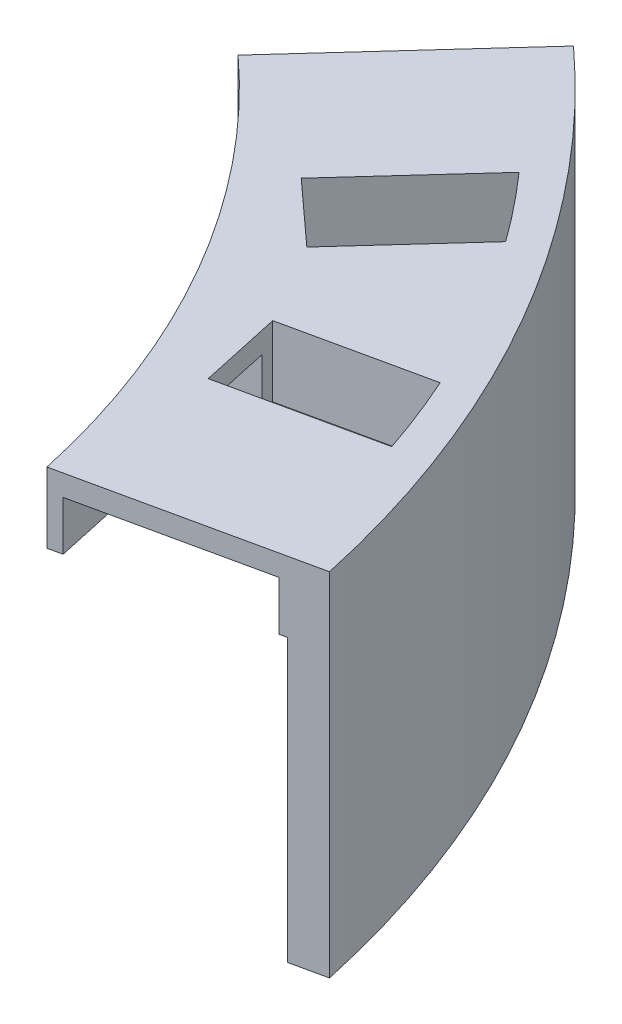
from build123d import *

# Parameters (mm, degrees)
BOSS_EXTRUDE1_DEPTH = 10
CUT_EXTRUDE1_DEPTH  = 7
BOSS_EXTRUDE2_START = -50
BOSS_EXTRUDE2_DEPTH = 50
CUT_EXTRUDE2_DEPTH  = 40
CUT_EXTRUDE3_DEPTH  = 7


with BuildPart() as part:
    # Sketch1 → Boss-Extrude1 (new body)
    with BuildSketch(Plane(origin=(0, 157.279655443, 0), x_dir=(1, 0, 0), z_dir=(0, 1, 0))):
        with BuildLine():
            Line((293.03566289, -316.199227389), (265.928972249, -322.110427169))
            ThreePointArc((265.928972249, -322.110427169), (252.377607393, -287.084094578), (228.819595995, -257.835102061))
            Line((228.819595995, -257.835102061), (247.492190492, -237.315619243))
            ThreePointArc((247.492190492, -237.315619243), (255.674613952, -244.45932236), (263.205967645, -252.286407351))
            Line((263.205967645, -252.286407351), (248.454819921, -268.496576877))
            Line((248.454819921, -268.496576877), (257.330112784, -276.573035048))
            Line((257.330112784, -276.573035048), (270.790876402, -261.780880276))
            ThreePointArc((270.790876402, -261.780880276), (277.704929826, -272.461358153), (283.49746828, -283.789342999))
            Line((283.49746828, -283.789342999), (263.956704662, -288.050628861))
            Line((263.956704662, -288.050628861), (266.513476179, -299.775087033))
            Line((266.513476179, -299.775087033), (287.92746865, -295.105303131))
            ThreePointArc((287.92746865, -295.105303131), (290.940246243, -305.54118925), (293.03566289, -316.199227389))
        make_face()
    extrude(amount=BOSS_EXTRUDE1_DEPTH)

    # Sketch2 → Cut-Extrude1 (cut)
    with BuildSketch(Plane(origin=(0, 157.279655443, 0), x_dir=(1, 0, 0), z_dir=(0, 1, 0))):
        Polygon((267.822908947, -321.697413337), (265.266137429, -309.972955165), (295.554321038, -303.367962079), (297.930502387, -315.13180184), align=None)
        Polygon((251.029855966, -233.428046687), (230.165672357, -256.355886583), (239.04096522, -264.432344755), (259.905148829, -241.504504858), align=None)
    extrude(amount=CUT_EXTRUDE1_DEPTH, mode=Mode.SUBTRACT)

    # Sketch3 → Boss-Extrude2 (add)
    with BuildSketch(Plane(origin=(0, 167.279655443, 0), x_dir=(1, 0, 0), z_dir=(0, 1, 0)).offset(BOSS_EXTRUDE2_START)):
        with BuildLine():
            Line((293.03566289, -316.199227389), (298.897891976, -314.920841631))
            ThreePointArc((298.897891976, -314.920841631), (281.600541129, -270.212225919), (251.530419577, -232.877972811))
            Line((251.530419577, -232.877972811), (247.492190492, -237.315619243))
            ThreePointArc((247.492190492, -237.315619243), (277.704929826, -272.461358153), (293.03566289, -316.199227389))
        make_face()
    extrude(amount=BOSS_EXTRUDE2_DEPTH)

    # Sketch4 → Cut-Extrude2 (cut)
    with BuildSketch(Plane.XZ.offset(-117.279655443)):
        with BuildLine():
            Line((293.03566289, 316.199227389), (294.012701071, 315.986163096))
            ThreePointArc((294.012701071, 315.986163096), (278.53244595, 271.983591496), (248.165228673, 236.576011504))
            Line((248.165228673, 236.576011504), (247.492190492, 237.315619243))
            ThreePointArc((247.492190492, 237.315619243), (277.704929826, 272.461358153), (293.03566289, 316.199227389))
        make_face()
    extrude(amount=-CUT_EXTRUDE2_DEPTH, mode=Mode.SUBTRACT)

    # Sketch5 → Cut-Extrude3 (cut)
    with BuildSketch(Plane(origin=(0, 157.279655443, 0), x_dir=(1, 0, 0), z_dir=(0, 1, 0))):
        Polygon((249.934035398, -269.842653239), (255.850897307, -275.226958686), (249.120515497, -282.623036072), (243.203653588, -277.238730625), align=None)
        Polygon((264.382833248, -290.004705223), (266.087347593, -297.821010671), (256.316965783, -299.951653602), (254.612451439, -292.135348154), align=None)
    extrude(amount=CUT_EXTRUDE3_DEPTH, mode=Mode.SUBTRACT)


solid = part.part
